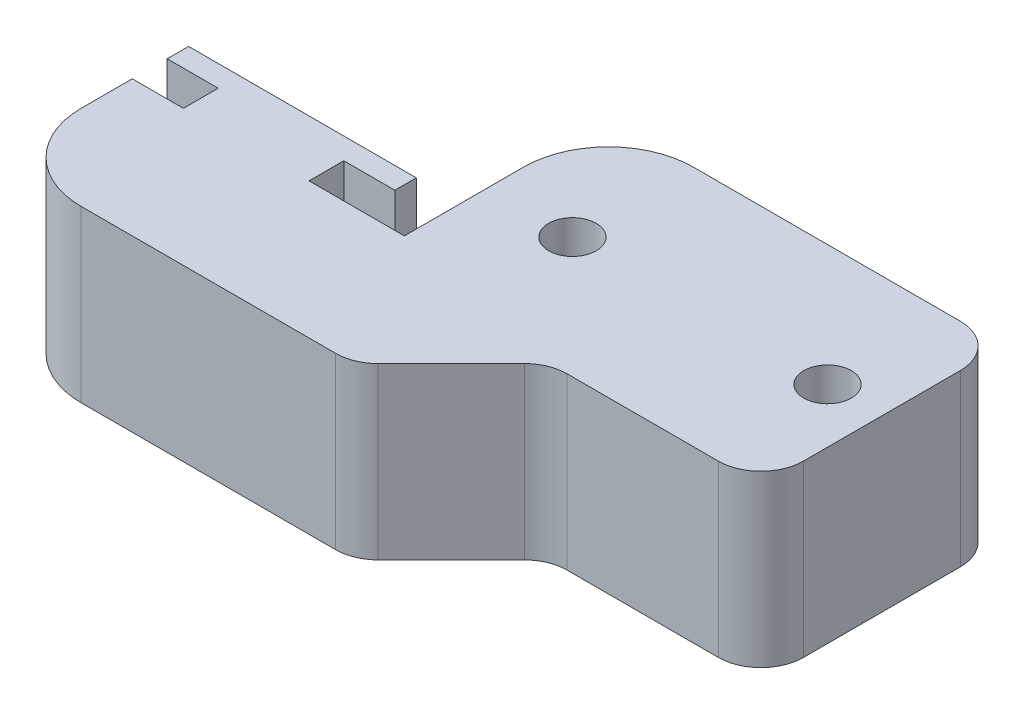
from build123d import *

# Parameters (mm, degrees)
SKETCH1_R           = 0.889
BOSS_EXTRUDE1_DEPTH = 6.35


with BuildPart() as part:
    # Sketch1 → Boss-Extrude1 (new body)
    with BuildSketch(Plane(origin=(0, 0, 0), x_dir=(1, 0, 0), z_dir=(0, 1, 0))):
        with BuildLine():
            Line((-32.390505008, 10.370660171), (-22.421005008, 10.370660171))
            ThreePointArc((-22.421005008, 10.370660171), (-21.298472993, 9.905692187), (-20.833505008, 8.783160171))
            Line((-20.833505008, 8.783160171), (-20.833505008, 2.918160067))
            ThreePointArc((-20.833505008, 2.918160067), (-21.298472993, 1.795628052), (-22.421005008, 1.330660067))
            Line((-22.421005008, 1.330660067), (-28.072941082, 1.330660067))
            ThreePointArc((-28.072941082, 1.330660067), (-28.680451031, 1.209818825), (-29.195473097, 0.865692083))
            Line((-29.195473097, 0.865692083), (-31.925537023, -1.864371844))
            ThreePointArc((-31.925537023, -1.864371844), (-32.440559089, -2.208498586), (-33.048069038, -2.329339829))
            Line((-33.048069038, -2.329339829), (-42.550505008, -2.329339829))
            ThreePointArc((-42.550505008, -2.329339829), (-44.795569038, -1.399403859), (-45.725505008, 0.845660171))
            Line((-45.725505008, 0.845660171), (-45.725505008, 2.750660171))
            Line((-45.725505008, 2.750660171), (-43.815505008, 2.750660171))
            Line((-43.815505008, 2.750660171), (-43.815505008, 4.050660171))
            Line((-43.815505008, 4.050660171), (-45.720505008, 4.050660171))
            Line((-45.720505008, 4.050660171), (-45.720505008, 4.850660171))
            Line((-45.720505008, 4.850660171), (-37.220505008, 4.850660171))
            Line((-37.220505008, 4.850660171), (-37.220505008, 4.050660171))
            Line((-37.220505008, 4.050660171), (-39.125505008, 4.050660171))
            Line((-39.125505008, 4.050660171), (-39.125505008, 2.750660171))
            Line((-39.125505008, 2.750660171), (-35.565505008, 2.750660171))
            Line((-35.565505008, 2.750660171), (-35.565505008, 7.195660171))
            ThreePointArc((-35.565505008, 7.195660171), (-34.635569038, 9.440724202), (-32.390505008, 10.370660171))
        make_face()
        with Locations(Location((-32.390505008, 5.850660171, 0), (0, 0, 270))):
            Circle(SKETCH1_R, mode=Mode.SUBTRACT)
        with Locations(Location((-22.865505008, 5.850660171, 0), (0, 0, 270))):
            Circle(SKETCH1_R, mode=Mode.SUBTRACT)
    extrude(amount=BOSS_EXTRUDE1_DEPTH)


solid = part.part
